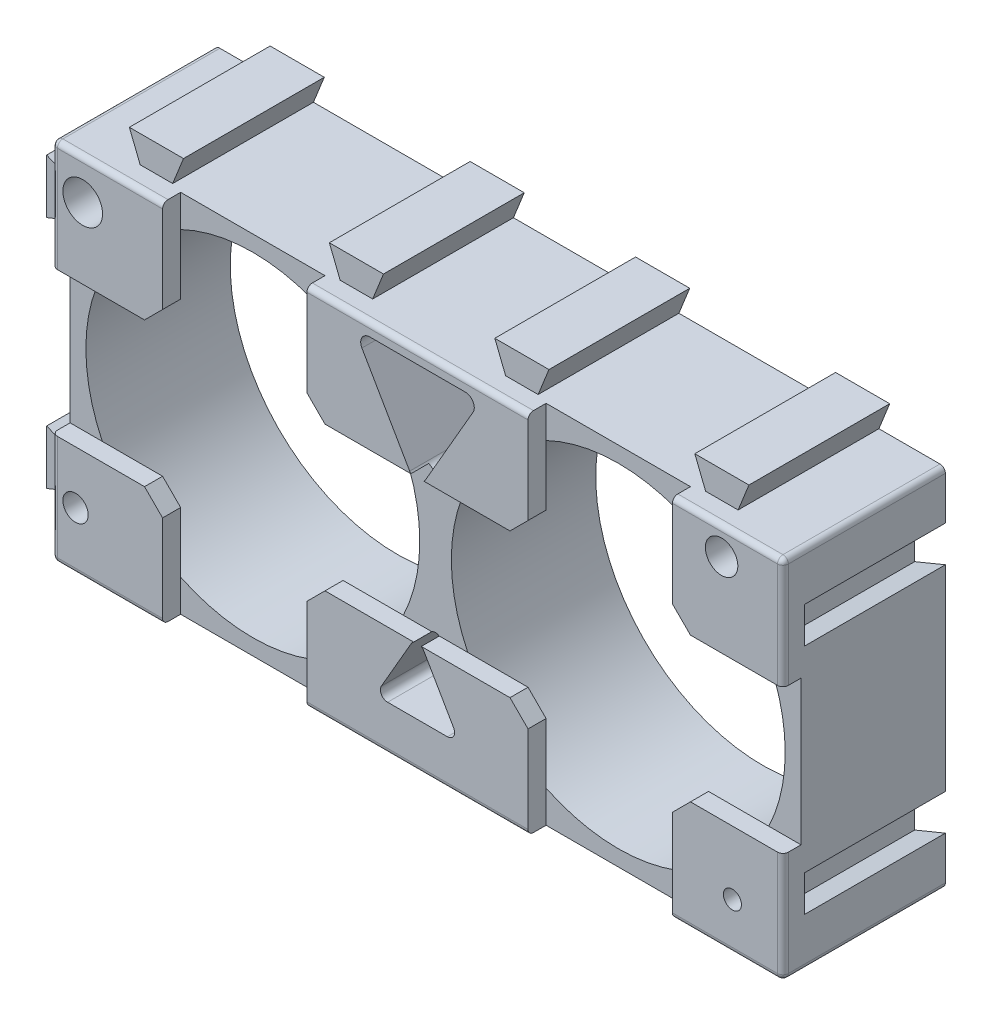
from build123d import *

# Parameters (mm, degrees)
SKETCH_1_W          = 40.5
SKETCH_1_H          = 20.25
EXTRUDE_1_DEPTH     = 9
CUT_EXTRUDE_START   = -1
SKETCH_2_R          = 9.25
CUT_EXTRUDE_1_DEPTH = 9
SKETCH_3_W          = 6.125
SKETCH_3_H          = 8
SKETCH_3_W_2        = 8
SKETCH_3_W_3        = 12.25
SKETCH_3_H_2        = 6.125
CUT_EXTRUDE_2_DEPTH = 1
CHAMFER_1_SIZE      = 1
SKETCH_4_R          = 1.1
SKETCH_4_R_2        = 0.7
SKETCH_4_R_3        = 0.9
SKETCH_4_R_4        = 0.5
CUT_EXTRUDE_3_DEPTH = 7.2
EXTRUDE_2_DEPTH     = 7.8
CUT_EXTRUDE_4_DEPTH = 7.8
FILLET_1_R          = 0.3


with BuildPart() as part:
    # Эскиз1 → Бобышка-Вытянуть1 (new body)
    with BuildSketch(Plane.XY):
        Rectangle(SKETCH_1_W, SKETCH_1_H)
    extrude(amount=EXTRUDE_1_DEPTH)

    # Эскиз2 → Вырез-Вытянуть1 (cut)
    with BuildSketch(Plane.XY.offset(9).offset(CUT_EXTRUDE_START)):
        with Locations((-10.125, 0)):
            Circle(SKETCH_2_R)
        with Locations((10.125, 0)):
            Circle(SKETCH_2_R)
    extrude(amount=-CUT_EXTRUDE_1_DEPTH, mode=Mode.SUBTRACT)

    # Эскиз3 → Вырез-Вытянуть2 (cut)
    with BuildSketch(Plane.XY.offset(9)):
        with Locations((-17.1875, 0)):
            Rectangle(SKETCH_3_W, SKETCH_3_H)
        with Locations((-10.125, 0)):
            Rectangle(SKETCH_3_W_2, SKETCH_3_H)
        Rectangle(SKETCH_3_W_3, SKETCH_3_H)
        with Locations((10.125, 0)):
            Rectangle(SKETCH_3_W_2, SKETCH_3_H)
        with Locations((17.1875, 0)):
            Rectangle(SKETCH_3_W, SKETCH_3_H)
        with Locations((10.125, 7.0625)):
            Rectangle(SKETCH_3_W_2, SKETCH_3_H_2)
        with Locations((-10.125, 7.0625)):
            Rectangle(SKETCH_3_W_2, SKETCH_3_H_2)
        with Locations((-10.125, -7.0625)):
            Rectangle(SKETCH_3_W_2, SKETCH_3_H_2)
        with Locations((10.125, -7.0625)):
            Rectangle(SKETCH_3_W_2, SKETCH_3_H_2)
    extrude(amount=-CUT_EXTRUDE_2_DEPTH, mode=Mode.SUBTRACT)

    # Фаска1
    chamfer_1_edges = [part.edges().sort_by_distance(p)[0] for p in [
        (-14.125, 4, 8.5),
        (-6.125, 4, 8.5),
        (6.125, 4, 8.5),
        (14.125, 4, 8.5),
        (14.125, -4, 8.5),
        (6.125, -4, 8.5),
        (-6.125, -4, 8.5),
        (-14.125, -4, 8.5),
    ]]
    chamfer(chamfer_1_edges, length=CHAMFER_1_SIZE)

    # Эскиз4 → Вырез-Вытянуть3 (cut)
    with BuildSketch(Plane.XY.offset(9)):
        with Locations((-18.55, 7.925)):
            Circle(SKETCH_4_R)
        with Locations((-18.95, -6.925)):
            Circle(SKETCH_4_R_2)
        with Locations((16.85, 8.625)):
            Circle(SKETCH_4_R_3)
        with Locations((17.45, -7.525)):
            Circle(SKETCH_4_R_4)
        with BuildLine():
            Line((3.079897776, 8.675), (0.433012702, 4.09046057))
            ThreePointArc((0.433012702, 4.09046057), (0, 3.84046057), (-0.433012702, 4.09046057))
            Line((-0.433012702, 4.09046057), (-3.079897776, 8.675))
            ThreePointArc((-3.079897776, 8.675), (-3.079897776, 9.175), (-2.646885074, 9.425))
            Line((-2.646885074, 9.425), (2.646885074, 9.425))
            ThreePointArc((2.646885074, 9.425), (3.079897776, 9.175), (3.079897776, 8.675))
        make_face()
        with BuildLine():
            Line((-0.346410162, -4.14), (-2.003589838, -7.010319398))
            ThreePointArc((-2.003589838, -7.010319398), (-2.003589838, -7.410319398), (-1.657179677, -7.610319398))
            Line((-1.657179677, -7.610319398), (1.657179677, -7.610319398))
            ThreePointArc((1.657179677, -7.610319398), (2.003589838, -7.410319398), (2.003589838, -7.010319398))
            Line((2.003589838, -7.010319398), (0.346410162, -4.14))
            ThreePointArc((0.346410162, -4.14), (0, -3.94), (-0.346410162, -4.14))
        make_face()
    extrude(amount=-CUT_EXTRUDE_3_DEPTH, mode=Mode.SUBTRACT)

    # Эскиз5 → Бобышка-Вытянуть2 (add)
    with BuildSketch(Plane(origin=(0, 0, 0), x_dir=(-1, 0, 0), z_dir=(0, 0, -1))):
        Polygon((-14.165851779, 11.625), (-17.165851779, 11.625), (-16.565851779, 10.125), (-14.765851779, 10.125), align=None)
        Polygon((-6.084148221, 11.625), (-5.484148221, 10.125), (-3.684148221, 10.125), (-3.084148221, 11.625), align=None)
        Polygon((6.084148221, 11.625), (3.084148221, 11.625), (3.684148221, 10.125), (5.484148221, 10.125), align=None)
        Polygon((14.165851779, 11.625), (14.765851779, 10.125), (16.565851779, 10.125), (17.165851779, 11.625), align=None)
        Polygon((20.25, 7.4), (20.25, 5.6), (21.75, 5), (21.75, 8), align=None)
        Polygon((20.25, -7.4), (21.75, -8), (21.75, -5), (20.25, -5.6), align=None)
    extrude(amount=-EXTRUDE_2_DEPTH)

    # Эскиз6 → Вырез-Вытянуть4 (cut)
    with BuildSketch(Plane(origin=(0, 0, 0), x_dir=(-1, 0, 0), z_dir=(0, 0, -1))):
        Polygon((17.365851779, -8.425), (16.665851779, -10.125), (14.665851779, -10.125), (13.965851779, -8.425), align=None)
        Polygon((6.284148221, -8.425), (2.884148221, -8.425), (3.584148221, -10.125), (5.584148221, -10.125), align=None)
        Polygon((-16.665851779, -10.125), (-14.665851779, -10.125), (-13.965851779, -8.425), (-17.365851779, -8.425), align=None)
        Polygon((-2.884148221, -8.425), (-3.584148221, -10.125), (-5.584148221, -10.125), (-6.284148221, -8.425), align=None)
        Polygon((-18.55, -4.739111724), (-18.55, -8.139111724), (-20.25, -7.439111724), (-20.25, -5.439111724), align=None)
        Polygon((-18.55, 8.139111724), (-20.25, 7.439111724), (-20.25, 5.439111724), (-18.55, 4.739111724), align=None)
    extrude(amount=-CUT_EXTRUDE_4_DEPTH, mode=Mode.SUBTRACT)

    # Скругление1
    fillet_1_edges = [part.edges().sort_by_distance(p)[0] for p in [
        (-20.25, 7.0625, 9),
        (-17.1875, -10.125, 9),
        (20.25, 7.0625, 9),
        (0, 10.125, 9),
        (-17.1875, 10.125, 9),
        (-20.25, -7.0625, 9),
        (0, -10.125, 9),
        (17.1875, -10.125, 9),
        (20.25, -7.0625, 9),
        (17.1875, 10.125, 9),
        (20.25, -10.125, 4.5),
        (-20.25, -10.125, 4.5),
        (-20.25, 10.125, 4.5),
        (20.25, 10.125, 4.5),
    ]]
    fillet(fillet_1_edges, radius=FILLET_1_R)


solid = part.part
